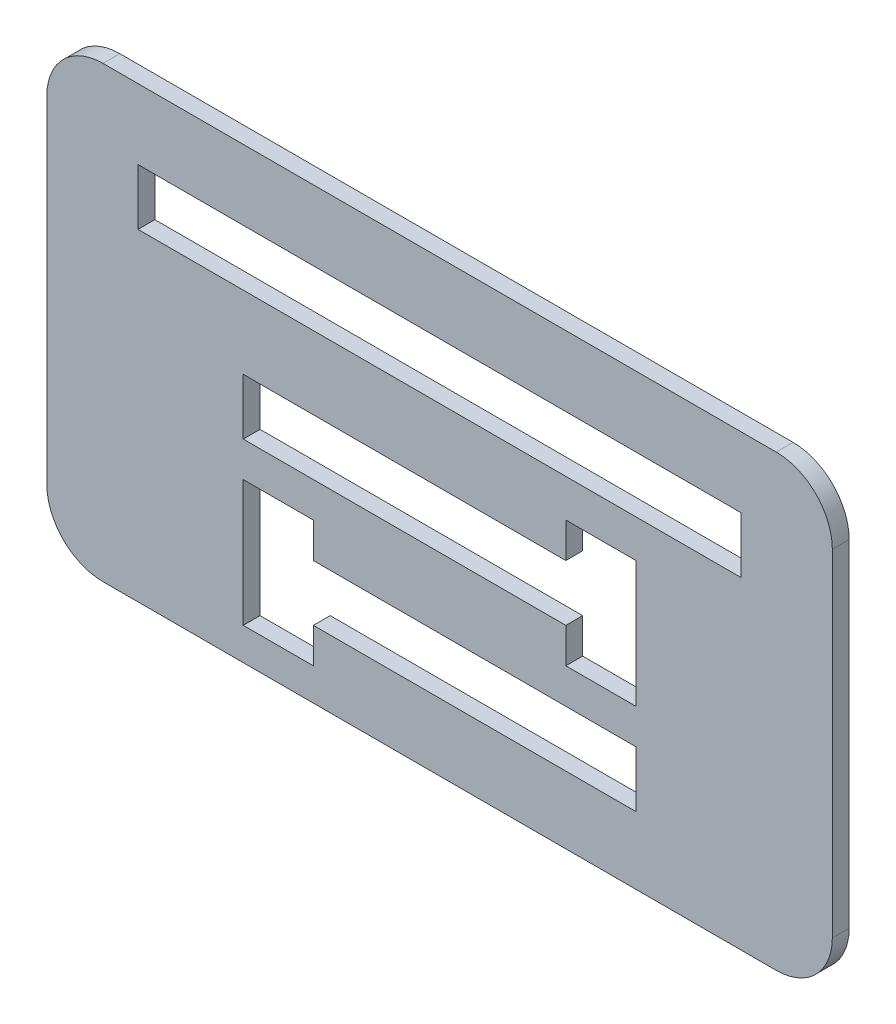
from build123d import *

# Parameters (mm, degrees)
BOSS_EXTRUDE1_DEPTH = 6
SKETCH2_W           = 215
SKETCH2_H           = 20
CUT_EXTRUDE1_DEPTH  = 6


with BuildPart() as part:
    # Sketch1 → Boss-Extrude1 (new body)
    with BuildSketch(Plane.XY):
        with BuildLine():
            Line((20, 0), (260, 0))
            ThreePointArc((260, 0), (274.142135624, 5.857864376), (280, 20))
            Line((280, 20), (280, 140))
            ThreePointArc((280, 140), (274.142135624, 154.142135624), (260, 160))
            Line((260, 160), (20, 160))
            ThreePointArc((20, 160), (5.857864376, 154.142135624), (0, 140))
            Line((0, 140), (0, 20))
            ThreePointArc((0, 20), (5.857864376, 5.857864376), (20, 0))
        make_face()
    extrude(amount=BOSS_EXTRUDE1_DEPTH)

    # Sketch2 → Cut-Extrude1 (cut)
    with BuildSketch(Plane.XY.offset(6)):
        with Locations((140, 125)):
            Rectangle(SKETCH2_W, SKETCH2_H)
        Polygon((70, 89.013901834), (185, 89.013901834), (185, 101.513901834), (210, 101.513901834), (210, 56.513901834), (185, 56.513901834), (185, 69.013901834), (70, 69.013901834), align=None)
        Polygon((95, 56.513901834), (95, 44.013901834), (210, 44.013901834), (210, 24.013901834), (95, 24.013901834), (95, 11.513901834), (70, 11.513901834), (70, 56.513901834), align=None)
    extrude(amount=-CUT_EXTRUDE1_DEPTH, mode=Mode.SUBTRACT)


solid = part.part
